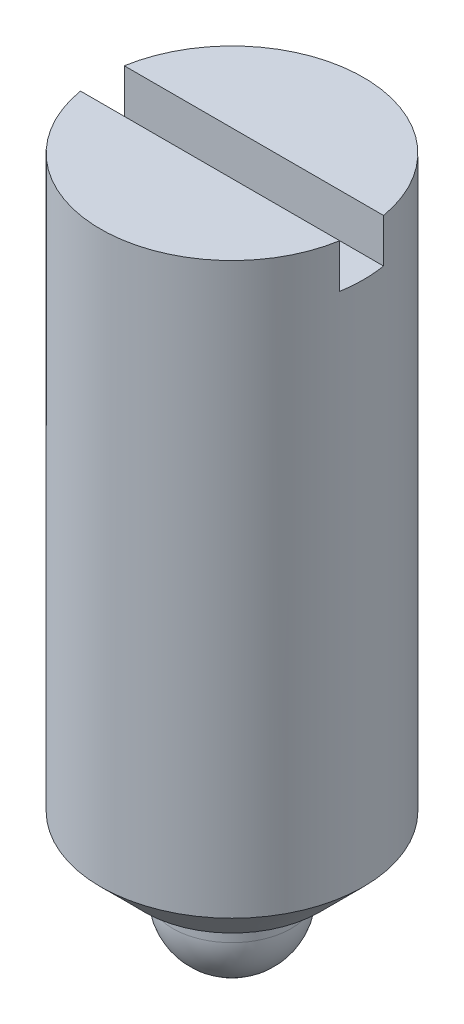
from build123d import *

# Parameters (mm, degrees)
CHAMFER1_SIZE      = 1
SKETCH2_W          = 6.946191838
SKETCH2_H          = 1
CUT_EXTRUDE1_DEPTH = 1


with BuildPart() as part:
    # Sketch1 → Revolve1 (revolve)
    with BuildSketch(Plane.XY):
        with BuildLine():
            Line((0, 0), (-3, 0))
            Line((-3, 0), (-3, -14))
            Line((-3, -14), (-1.35, -14))
            Line((-1.35, -14), (-1.35, -14.65))
            ThreePointArc((-1.35, -14.65), (-0.954594155, -15.604594155), (0, -16))
            Line((0, -16), (0, 0))
        make_face()
    revolve(axis=Axis((0, -16, 0), (0, 1, 0)))

    # Chamfer1
    chamfer1_edges = [part.edges().sort_by_distance(p)[0] for p in [
        (3, -14, 0),
    ]]
    chamfer(chamfer1_edges, length=CHAMFER1_SIZE)

    # Sketch2 → Cut-Extrude1 (cut)
    with BuildSketch(Plane(origin=(0, 0, 0), x_dir=(1, 0, 0), z_dir=(0, 1, 0))):
        Rectangle(SKETCH2_W, SKETCH2_H)
    extrude(amount=-CUT_EXTRUDE1_DEPTH, mode=Mode.SUBTRACT)


solid = part.part
